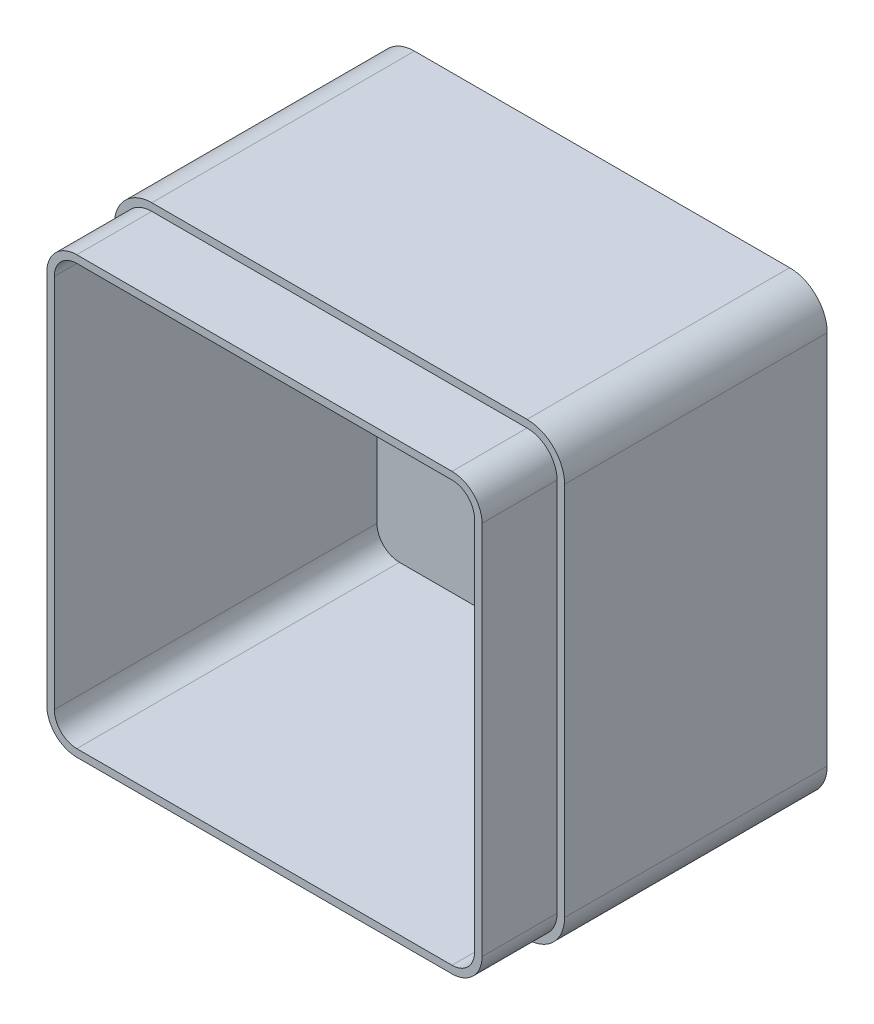
from build123d import *

# Parameters (mm, degrees)
CROQUIS1_W              = 120
CROQUIS1_H              = 120
SALIENTE_EXTRUIR1_DEPTH = 90
REDONDEO2_R             = 10
VACIADO2_T              = -4
CORTAR_EXTRUIR2_DEPTH   = 20


with BuildPart() as part:
    # Croquis1 → Saliente-Extruir1 (new body)
    with BuildSketch(Plane.XY):
        with Locations((60, 60)):
            Rectangle(CROQUIS1_W, CROQUIS1_H)
    extrude(amount=SALIENTE_EXTRUIR1_DEPTH)

    # Redondeo2
    redondeo2_edges = [part.edges().sort_by_distance(p)[0] for p in [
        (0, 120, 45),
        (120, 120, 45),
        (120, 0, 45),
        (0, 0, 45),
    ]]
    fillet(redondeo2_edges, radius=REDONDEO2_R)

    # Vaciado2
    vaciado2_openings = [part.faces().sort_by_distance(p)[0] for p in [
        (60, 60, 90),
    ]]
    offset(amount=VACIADO2_T, openings=vaciado2_openings, kind=Kind.INTERSECTION)

    # Croquis7 → Cortar-Extruir2 (cut)
    with BuildSketch(Plane.XY.offset(90)):
        with BuildLine():
            Line((120, 10), (120, 110))
            ThreePointArc((120, 110), (117.071067812, 117.071067812), (110, 120))
            Line((110, 120), (10, 120))
            ThreePointArc((10, 120), (2.928932188, 117.071067812), (0, 110))
            Line((0, 110), (0, 10))
            ThreePointArc((0, 10), (2.928932188, 2.928932188), (10, 0))
            Line((10, 0), (110, 0))
            ThreePointArc((110, 0), (117.071067812, 2.928932188), (120, 10))
        make_face()
        with BuildLine():
            Line((2, 110), (2, 10))
            ThreePointArc((2, 10), (4.343145751, 4.343145751), (10, 2))
            Line((10, 2), (110, 2))
            ThreePointArc((110, 2), (115.656854249, 4.343145751), (118, 10))
            Line((118, 10), (118, 110))
            ThreePointArc((118, 110), (115.656854249, 115.656854249), (110, 118))
            Line((110, 118), (10, 118))
            ThreePointArc((10, 118), (4.343145751, 115.656854249), (2, 110))
        make_face(mode=Mode.SUBTRACT)
    extrude(amount=-CORTAR_EXTRUIR2_DEPTH, mode=Mode.SUBTRACT)


solid = part.part
